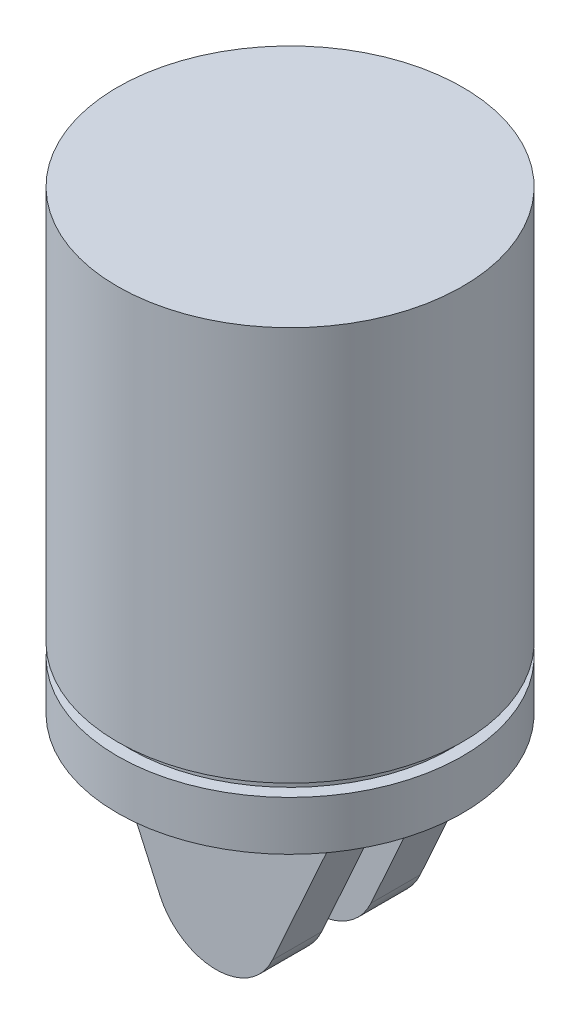
from build123d import *

# Parameters (mm, degrees)
BOSS_EXTRUDE1_START = 5
BOSS_EXTRUDE1_DEPTH = 10
LPATTERN1_COUNT     = 2
LPATTERN1_PITCH     = 20
SKETCH2_R           = 35
SKETCH2_R_2         = 32.5
SKETCH2_W           = 50
SKETCH2_H           = 10
BOSS_EXTRUDE2_DEPTH = 10
BOSS_EXTRUDE3_START = 10
SKETCH2_3_R         = 32.5
BOSS_EXTRUDE3_DEPTH = 2.5
BOSS_EXTRUDE4_START = 12.5
SKETCH2_4_R         = 35
BOSS_EXTRUDE4_DEPTH = 80


with BuildPart() as part:
    # Sketch1 → Boss-Extrude1 (new body)
    with BuildSketch(Plane.XY.offset(BOSS_EXTRUDE1_START)):
        with BuildLine():
            Line((-11.392972847, -5.142972847), (-25, 25))
            Line((-25, 25), (25, 25))
            Line((25, 25), (11.392972847, -5.142972847))
            ThreePointArc((11.392972847, -5.142972847), (0, -12.5), (-11.392972847, -5.142972847))
        make_face()
    extrude(amount=BOSS_EXTRUDE1_DEPTH)


with BuildPart() as lpattern1_1:
    # LPattern1: pattern copy
    add(part.part.moved(Location(Vector(0, 0, -1) * (1 * LPATTERN1_PITCH))))


with BuildPart() as part_1:
    add(part.part)

    add(lpattern1_1.part)  # Boss-Extrude2 merges LPattern1_1
    # Sketch2 → Boss-Extrude2 (add)
    # profile 1 of 3: a face of its own
    with BuildSketch(Plane(origin=(0, 25, 0), x_dir=(1, 0, 0), z_dir=(0, 1, 0))):
        with Locations(Location((0, 0, 0), (0, 0, 270))):
            Circle(SKETCH2_R)
        Circle(SKETCH2_R_2, mode=Mode.SUBTRACT)
    # profile 2 of 3: a face of its own
    with BuildSketch(Plane(origin=(0, 25, 0), x_dir=(1, 0, 0), z_dir=(0, 1, 0))):
        Circle(SKETCH2_R_2)
        with Locations((0, -10)):
            Rectangle(SKETCH2_W, SKETCH2_H, mode=Mode.SUBTRACT)
    # profile 3 of 3: a face of its own
    with BuildSketch(Plane(origin=(0, 25, 0), x_dir=(1, 0, 0), z_dir=(0, 1, 0))):
        with Locations((0, -10)):
            Rectangle(SKETCH2_W, SKETCH2_H)
    extrude(amount=BOSS_EXTRUDE2_DEPTH)

    # Sketch2<3> → Boss-Extrude3 (add)
    with BuildSketch(Plane(origin=(0, 25, 0), x_dir=(1, 0, 0), z_dir=(0, 1, 0)).offset(BOSS_EXTRUDE3_START)):
        with Locations(Location((0, 0, 0), (0, 0, 270))):
            Circle(SKETCH2_3_R)
    extrude(amount=BOSS_EXTRUDE3_DEPTH)

    # Sketch2<4> → Boss-Extrude4 (add)
    with BuildSketch(Plane(origin=(0, 25, 0), x_dir=(1, 0, 0), z_dir=(0, 1, 0)).offset(BOSS_EXTRUDE4_START)):
        with Locations(Location((0, 0, 0), (0, 0, 270))):
            Circle(SKETCH2_4_R)
    extrude(amount=BOSS_EXTRUDE4_DEPTH)


solid = part_1.part
